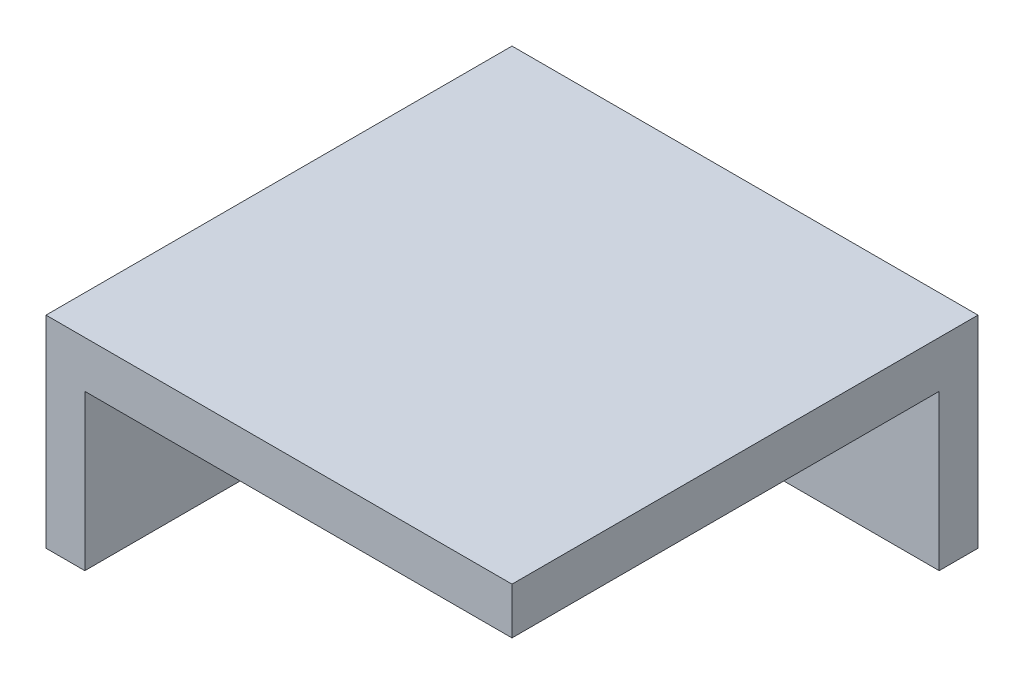
from build123d import *

# Parameters (mm, degrees)
SKETCH1_W           = 60
SKETCH1_H           = 60
BOSS_EXTRUDE1_DEPTH = 6
BOSS_EXTRUDE2_DEPTH = 20


with BuildPart() as part:
    # Sketch1 → Boss-Extrude1 (new body)
    with BuildSketch(Plane(origin=(0, 0, 0), x_dir=(1, 0, 0), z_dir=(0, 1, 0))):
        Rectangle(SKETCH1_W, SKETCH1_H)
    extrude(amount=BOSS_EXTRUDE1_DEPTH)

    # Sketch2 → Boss-Extrude2 (add)
    with BuildSketch(Plane(origin=(0, 0, 0), x_dir=(1, 0, 0), z_dir=(0, 1, 0))):
        Polygon((-30, 30), (-30, -30), (-25, -30), (-25, 25), (30, 25), (30, 30), align=None)
    extrude(amount=-BOSS_EXTRUDE2_DEPTH)


solid = part.part
